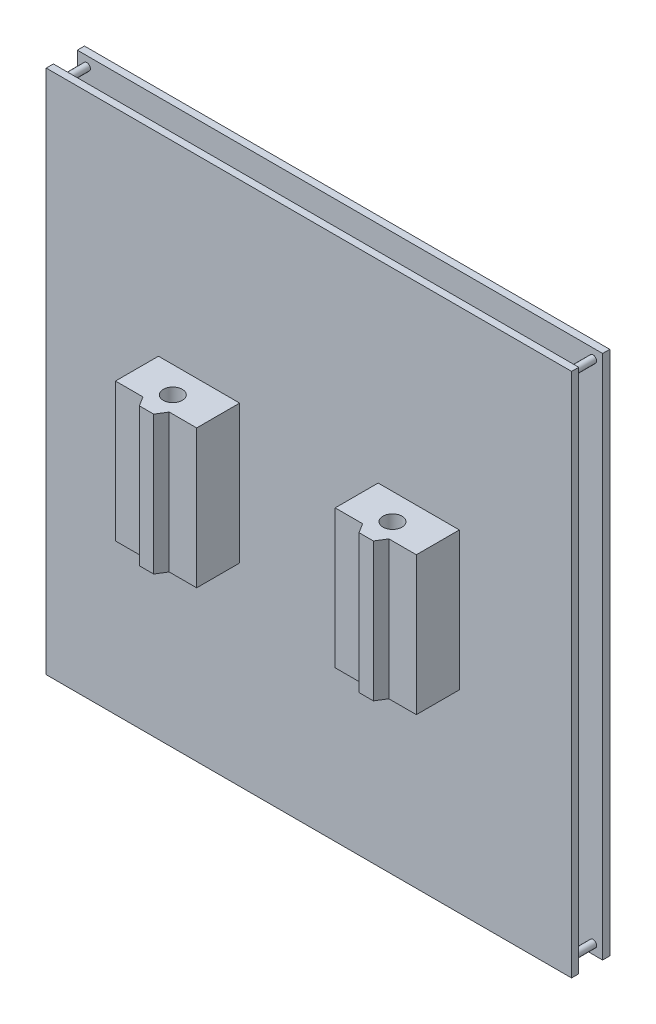
from build123d import *

# Parameters (mm, degrees)
SKETCH_1_W          = 220
SKETCH_1_H          = 220
EXTRUDE_1_DEPTH     = 3
SKETCH_2_R          = 1.5
EXTRUDE_2_DEPTH     = 10
SKETCH_3_W          = 220
SKETCH_3_H          = 220
EXTRUDE_3_DEPTH     = 3
SKETCH_4_W          = 34
SKETCH_4_H          = 58
EXTRUDE_4_DEPTH     = 22
SKETCH_5_R          = 4
CUT_EXTRUDE_1_DEPTH = 182.287065176


with BuildPart() as part:
    # 草圖1 → 填料-伸長1 (new body)
    with BuildSketch(Plane.XY):
        Rectangle(SKETCH_1_W, SKETCH_1_H)
    extrude(amount=EXTRUDE_1_DEPTH)

    # 草圖2 → 填料-伸長2 (add)
    with BuildSketch(Plane.XY.offset(3)):
        with Locations((-106, 106)):
            Circle(SKETCH_2_R)
        with Locations((106, 106)):
            Circle(SKETCH_2_R)
        with Locations((106, -106)):
            Circle(SKETCH_2_R)
        with Locations((-106, -106)):
            Circle(SKETCH_2_R)
    extrude(amount=EXTRUDE_2_DEPTH)

    # 草圖3 → 填料-伸長3 (add)
    with BuildSketch(Plane.XY.offset(13)):
        Rectangle(SKETCH_3_W, SKETCH_3_H)
    extrude(amount=EXTRUDE_3_DEPTH)

    # 草圖4 → 填料-伸長4 (add)
    with BuildSketch(Plane.XY.offset(16)):
        with Locations((-46, 0)):
            Rectangle(SKETCH_4_W, SKETCH_4_H)
    extrude_4 = extrude(amount=EXTRUDE_4_DEPTH)

    # 草圖5 → 除料-伸長1 (cut, symmetric)
    with BuildSketch(Plane(origin=(0, 29, 0), x_dir=(1, 0, 0), z_dir=(0, 1, 0))):
        with Locations(Location((-46, -27, 0), (0, 0, 270))):
            Circle(SKETCH_5_R)
        Polygon((-63, -34), (-51.5, -34), (-49, -38), (-63, -38), align=None)
        Polygon((-29, -38), (-29, -34), (-40.5, -34), (-43, -38), align=None)
    cut_extrude_1 = extrude(amount=CUT_EXTRUDE_1_DEPTH, both=True, mode=Mode.SUBTRACT)

    # 鏡射1: 填料-伸長4, 除料-伸長1 across plane
    add(extrude_4.mirror(Plane(origin=(0, 0, 0), x_dir=(0, 0, 1), z_dir=(1, 0, 0))))
    add(cut_extrude_1.mirror(Plane(origin=(0, 0, 0), x_dir=(0, 0, 1), z_dir=(1, 0, 0))), mode=Mode.SUBTRACT)


solid = part.part
